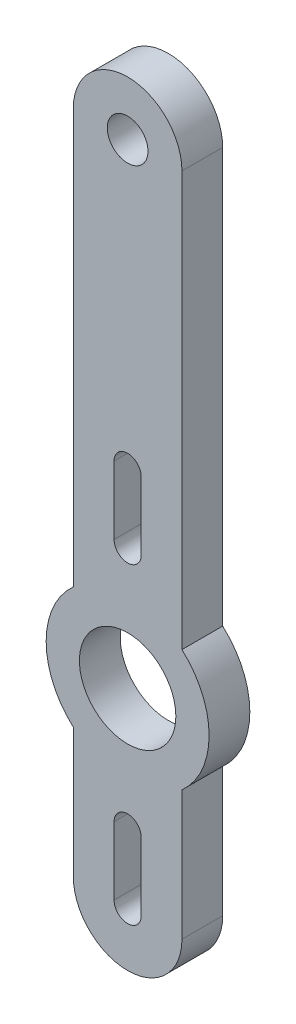
from build123d import *

# Parameters (mm, degrees)
SKETCH1_R           = 3.55
SKETCH1_R_2         = 1.5
BOSS_EXTRUDE1_DEPTH = 3


with BuildPart() as part:
    # Sketch1 → Boss-Extrude1 (new body)
    with BuildSketch(Plane.XY):
        with BuildLine():
            Line((4, 0), (4, 9.527864045))
            ThreePointArc((4, 9.527864045), (6, 14), (4, 18.472135955))
            Line((4, 18.472135955), (4, 49))
            ThreePointArc((4, 49), (0, 53), (-4, 49))
            Line((-4, 49), (-4, 18.472135955))
            ThreePointArc((-4, 18.472135955), (-6, 14), (-4, 9.527864045))
            Line((-4, 9.527864045), (-4, 0))
            ThreePointArc((-4, 0), (0, -4), (4, 0))
        make_face()
        with Locations((0, 14)):
            Circle(SKETCH1_R, mode=Mode.SUBTRACT)
        with Locations((0, 49)):
            Circle(SKETCH1_R_2, mode=Mode.SUBTRACT)
        with BuildLine():
            Line((-1, 0), (-1, 5))
            ThreePointArc((-1, 5), (0, 6), (1, 5))
            Line((1, 5), (1, 0))
            ThreePointArc((1, 0), (0, -1), (-1, 0))
        make_face(mode=Mode.SUBTRACT)
        with BuildLine():
            Line((-1, 28), (-1, 23))
            ThreePointArc((-1, 23), (0, 22), (1, 23))
            Line((1, 23), (1, 28))
            ThreePointArc((1, 28), (0, 29), (-1, 28))
        make_face(mode=Mode.SUBTRACT)
    extrude(amount=BOSS_EXTRUDE1_DEPTH)


solid = part.part
